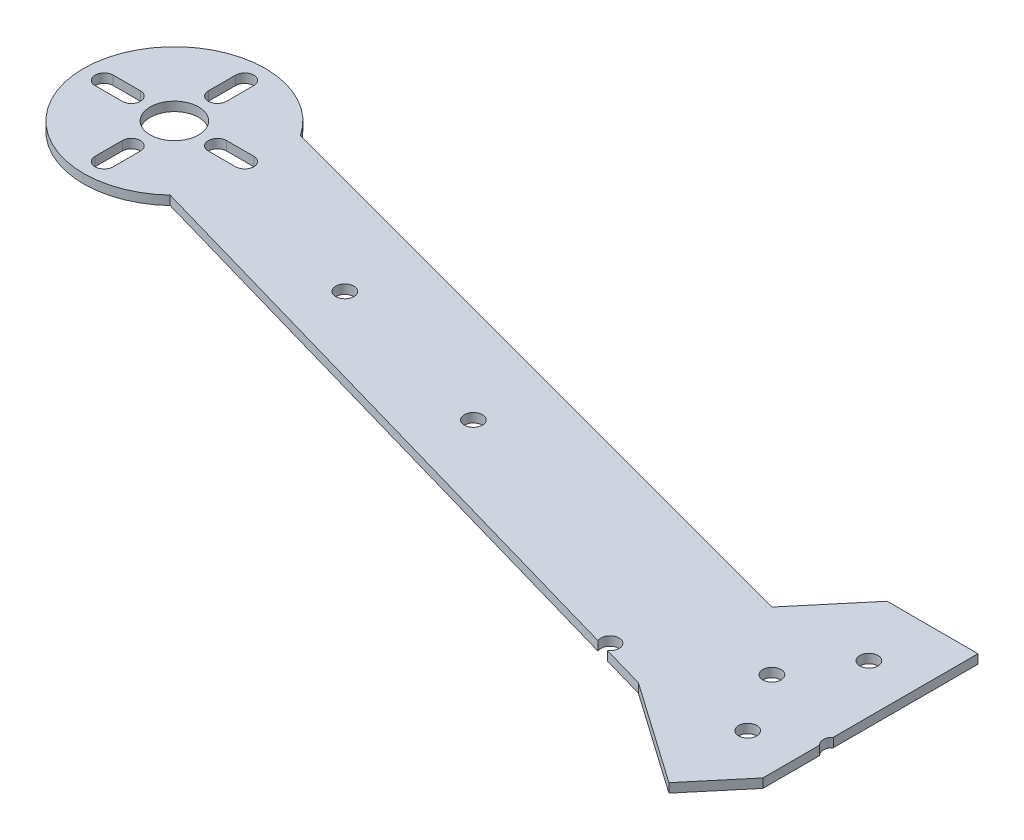
from build123d import *

# Parameters (mm, degrees)
SKETCH1_R           = 1.5
SKETCH1_R_2         = 4
BOSS_EXTRUDE1_DEPTH = 1.5


with BuildPart() as part:
    # Sketch1 → Boss-Extrude1 (new body)
    with BuildSketch(Plane(origin=(0, 0, 0), x_dir=(1, 0, 0), z_dir=(0, 1, 0))):
        with BuildLine():
            Line((-7.070663707, -8.426488874), (0, 0))
            Line((0, 0), (0, 9.381966011))
            ThreePointArc((0, 9.381966011), (-0.5, 10.5), (0, 11.618033989))
            Line((0, 11.618033989), (0, 35.5))
            Line((0, 35.5), (-15, 35.5))
            Line((-15, 35.5), (-23.677632731, 25.158400018))
            Line((-23.677632731, 25.158400018), (-129.929473623, 53.628494979))
            ThreePointArc((-129.929473623, 53.628494979), (-157.327989791, 47.078833109), (-132.17932297, 34.38547595))
            Line((-132.17932297, 34.38547595), (-33.223789423, 6.015437425))
            ThreePointArc((-33.223789423, 6.015437425), (-31.446611343, 8.081911862), (-31.03429168, 5.387719772))
            Line((-31.03429168, 5.387719772), (-23.863280614, 3.331828071))
            Line((-23.863280614, 3.331828071), (-7.070663707, -8.426488874))
        make_face()
        with Locations(Location((-8, 5.5, 0), (0, 0, 270))):
            Circle(SKETCH1_R, mode=Mode.SUBTRACT)
        with Locations(Location((-14, 15.5, 0), (0, 0, 270))):
            Circle(SKETCH1_R, mode=Mode.SUBTRACT)
        with Locations(Location((-8, 25.5, 0), (0, 0, 270))):
            Circle(SKETCH1_R, mode=Mode.SUBTRACT)
        with BuildLine():
            ThreePointArc((-143.929473623, 38.236933003), (-142.429473623, 39.736933003), (-140.929473623, 38.236933003))
            Line((-140.929473623, 38.236933003), (-140.929473623, 33.736933003))
            ThreePointArc((-140.929473623, 33.736933003), (-142.429473623, 32.236933003), (-143.929473623, 33.736933003))
            Line((-143.929473623, 33.736933003), (-143.929473623, 38.236933003))
        make_face(mode=Mode.SUBTRACT)
        with Locations(Location((-104.014603511, 35.04369958, 0), (0, 0, 270))):
            Circle(SKETCH1_R, mode=Mode.SUBTRACT)
        with BuildLine():
            ThreePointArc((-149.529473623, 46.836933003), (-148.029473623, 45.336933003), (-149.529473623, 43.836933003))
            Line((-149.529473623, 43.836933003), (-154.029473623, 43.836933003))
            ThreePointArc((-154.029473623, 43.836933003), (-155.529473623, 45.336933003), (-154.029473623, 46.836933003))
            Line((-154.029473623, 46.836933003), (-149.529473623, 46.836933003))
        make_face(mode=Mode.SUBTRACT)
        with Locations(Location((-142.429473623, 45.336933003, 0), (0, 0, 270))):
            Circle(SKETCH1_R_2, mode=Mode.SUBTRACT)
        with BuildLine():
            ThreePointArc((-135.329473623, 43.836933003), (-136.829473623, 45.336933003), (-135.329473623, 46.836933003))
            Line((-135.329473623, 46.836933003), (-130.829473623, 46.836933003))
            ThreePointArc((-130.829473623, 46.836933003), (-129.329473623, 45.336933003), (-130.829473623, 43.836933003))
            Line((-130.829473623, 43.836933003), (-135.329473623, 43.836933003))
        make_face(mode=Mode.SUBTRACT)
        with BuildLine():
            ThreePointArc((-140.929473623, 52.436933003), (-142.429473623, 50.936933003), (-143.929473623, 52.436933003))
            Line((-143.929473623, 52.436933003), (-143.929473623, 56.936933003))
            ThreePointArc((-143.929473623, 56.936933003), (-142.429473623, 58.436933003), (-140.929473623, 56.936933003))
            Line((-140.929473623, 56.936933003), (-140.929473623, 52.436933003))
        make_face(mode=Mode.SUBTRACT)
        with Locations(Location((-75.036828722, 27.279128226, 0), (0, 0, 270))):
            Circle(SKETCH1_R, mode=Mode.SUBTRACT)
    extrude(amount=BOSS_EXTRUDE1_DEPTH)


solid = part.part
